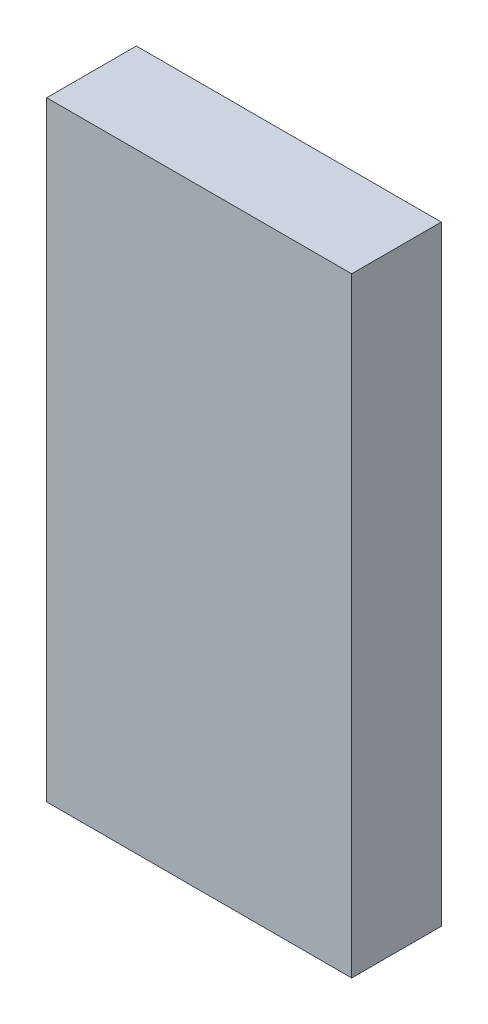
from build123d import *

# Parameters (mm, degrees)
SKETCH1_W           = 245
SKETCH1_H           = 490
BOSS_EXTRUDE1_DEPTH = 72


with BuildPart() as part:
    # Sketch1 → Boss-Extrude1 (new body)
    with BuildSketch(Plane.XY):
        Rectangle(SKETCH1_W, SKETCH1_H)
    extrude(amount=BOSS_EXTRUDE1_DEPTH)


solid = part.part
